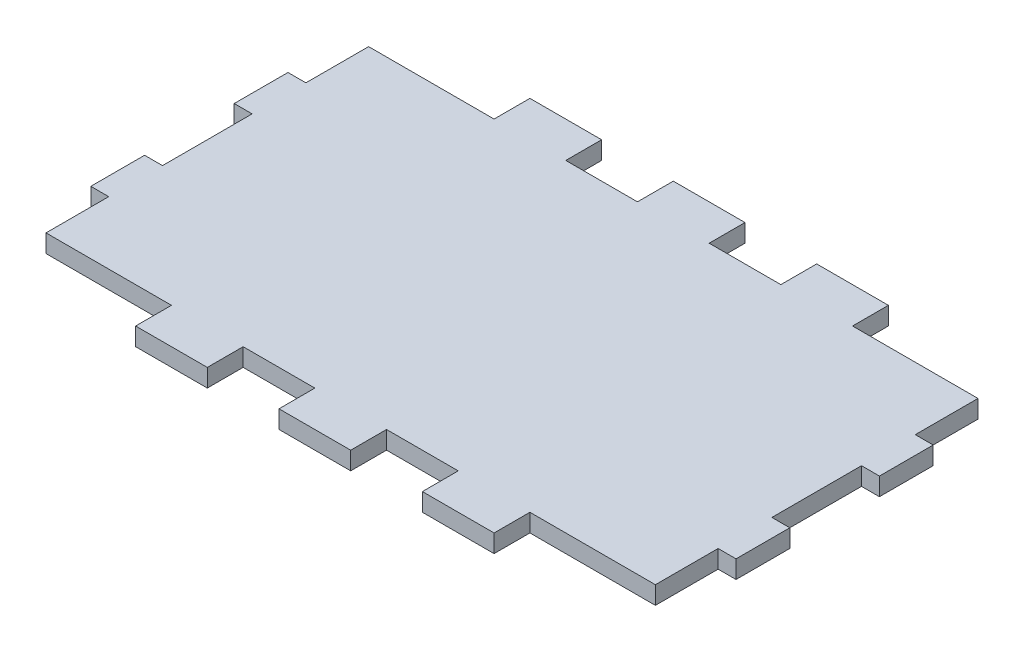
from build123d import *

# Parameters (mm, degrees)
ESQUISSE1_W             = 180
ESQUISSE1_H             = 110
BOSS_EXTRU_1_DEPTH      = 5
ESQUISSE2_W             = 20
ESQUISSE2_H             = 10
ESQUISSE2_W_2           = 5
ESQUISSE2_H_2           = 25
ENL_V_MAT_EXTRU_1_DEPTH = 5


with BuildPart() as part:
    # Esquisse1 → Boss.-Extru.1 (new body)
    with BuildSketch(Plane(origin=(0, 0, 0), x_dir=(1, 0, 0), z_dir=(0, 1, 0))):
        Rectangle(ESQUISSE1_W, ESQUISSE1_H)
    extrude(amount=BOSS_EXTRU_1_DEPTH)

    # Esquisse2 → Enlèv. mat.-Extru.1 (cut)
    with BuildSketch(Plane(origin=(0, 5, 0), x_dir=(1, 0, 0), z_dir=(0, 1, 0))):
        Polygon((-90, 55), (-90, 27.5), (-85, 27.5), (-85, 45), (-50, 45), (-50, 55), align=None)
        Polygon((85, 27.5), (90, 27.5), (90, 55), (50, 55), (50, 45), (85, 45), align=None)
        with Locations((20, 50)):
            Rectangle(ESQUISSE2_W, ESQUISSE2_H)
        with Locations((-20, 50)):
            Rectangle(ESQUISSE2_W, ESQUISSE2_H)
        with Locations((-87.5, 0)):
            Rectangle(ESQUISSE2_W_2, ESQUISSE2_H_2)
        Polygon((-90, -55), (-50, -55), (-50, -45), (-85, -45), (-85, -27.5), (-90, -27.5), align=None)
        Polygon((50, -45), (50, -55), (90, -55), (90, -27.5), (85, -27.5), (85, -45), align=None)
        with Locations((87.5, 0)):
            Rectangle(ESQUISSE2_W_2, ESQUISSE2_H_2)
        with Locations((20, -50)):
            Rectangle(ESQUISSE2_W, ESQUISSE2_H)
        with Locations((-20, -50)):
            Rectangle(ESQUISSE2_W, ESQUISSE2_H)
    extrude(amount=-ENL_V_MAT_EXTRU_1_DEPTH, mode=Mode.SUBTRACT)


solid = part.part
